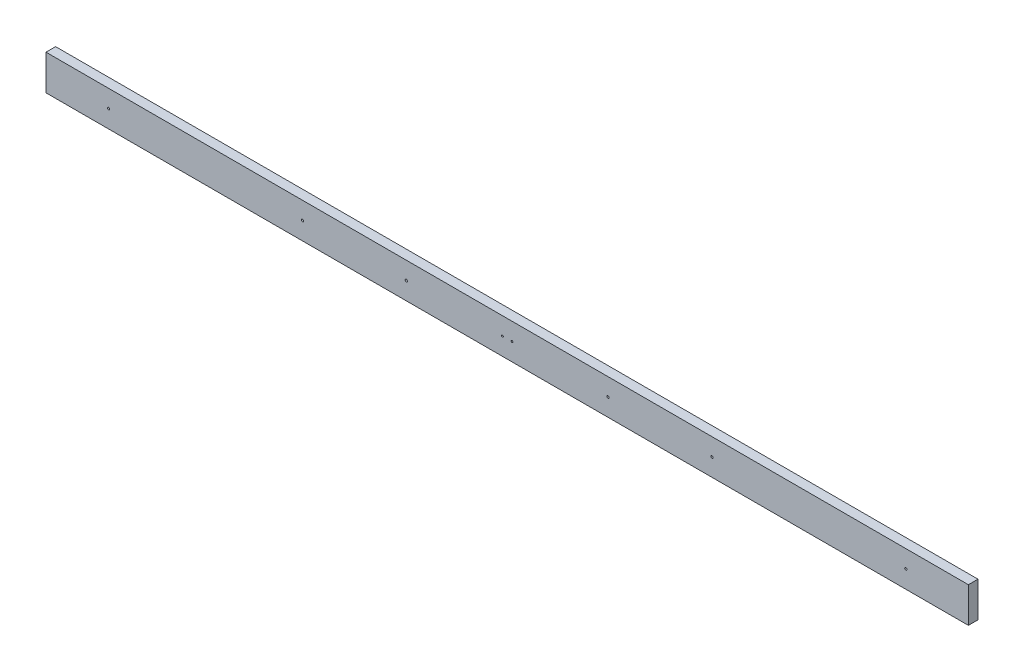
from build123d import *

# Parameters (mm, degrees)
SKETCH1_W           = 3657.6
SKETCH1_H           = 139.7
BOSS_EXTRUDE1_DEPTH = 38.1
SKETCH3_R           = 3.571875
CUT_EXTRUDE2_DEPTH  = 1831.529997706
SKETCH5_R           = 4.49961
CUT_EXTRUDE3_DEPTH  = 1831.529997706
SKETCH6_R           = 4.4996
CUT_EXTRUDE4_DEPTH  = 1831.529997706


with BuildPart() as part:
    # Sketch1 → Boss-Extrude1 (new body)
    with BuildSketch(Plane.XY):
        Rectangle(SKETCH1_W, SKETCH1_H)
    extrude(amount=BOSS_EXTRUDE1_DEPTH)

    # Sketch3 → Cut-Extrude2 (cut, through all)
    with BuildSketch(Plane.XY.offset(38.1)):
        with Locations((-19.05, 0)):
            Circle(SKETCH3_R)
        with Locations((19.05, 0)):
            Circle(SKETCH3_R)
    extrude(amount=-CUT_EXTRUDE2_DEPTH, mode=Mode.SUBTRACT)

    # Sketch5 → Cut-Extrude3 (cut, through all)
    with BuildSketch(Plane.XY.offset(38.1)):
        with Locations((400, 0)):
            Circle(SKETCH5_R)
        with Locations((-400, 0)):
            Circle(SKETCH5_R)
    extrude(amount=-CUT_EXTRUDE3_DEPTH, mode=Mode.SUBTRACT)

    # Sketch6 → Cut-Extrude4 (cut, through all)
    with BuildSketch(Plane.XY.offset(38.1)):
        with Locations((811.94, 0)):
            Circle(SKETCH6_R)
        with Locations((1580.6608, 0)):
            Circle(SKETCH6_R)
        with Locations((-1580.6608, 0)):
            Circle(SKETCH6_R)
        with Locations((-811.94, 0)):
            Circle(SKETCH6_R)
    extrude(amount=-CUT_EXTRUDE4_DEPTH, mode=Mode.SUBTRACT)


solid = part.part
